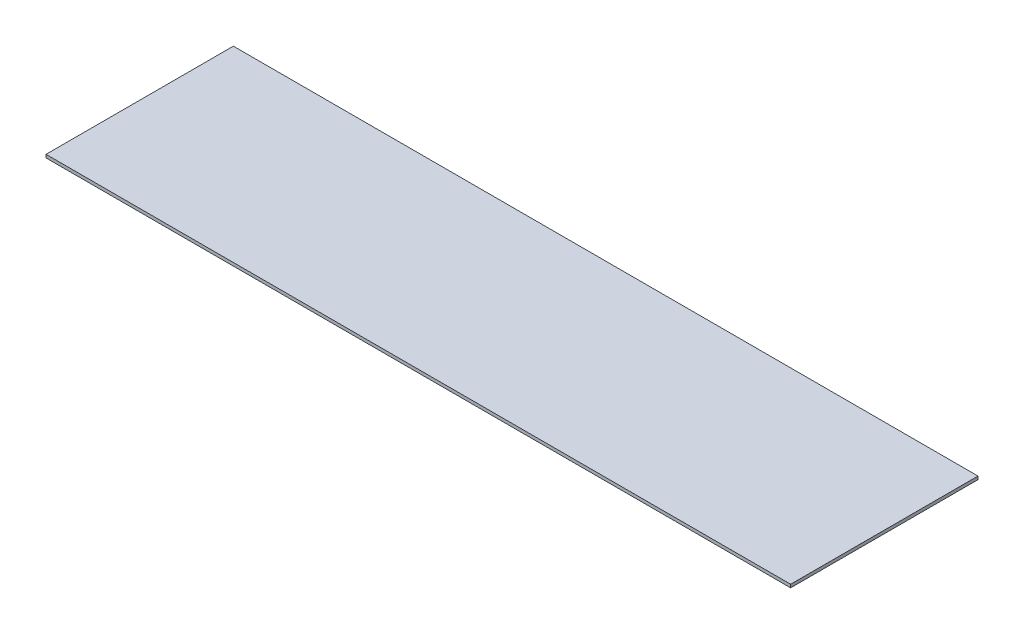
from build123d import *

# Parameters (mm, degrees)
SKETCH_1_W      = 2138
SKETCH_1_H      = 538
EXTRUDE_1_DEPTH = 9


with BuildPart() as part:
    # Эскиз1 → Бобышка-Вытянуть1 (new body)
    with BuildSketch(Plane(origin=(0, 0, 0), x_dir=(1, 0, 0), z_dir=(0, 1, 0))):
        Rectangle(SKETCH_1_W, SKETCH_1_H)
    extrude(amount=EXTRUDE_1_DEPTH)


solid = part.part
